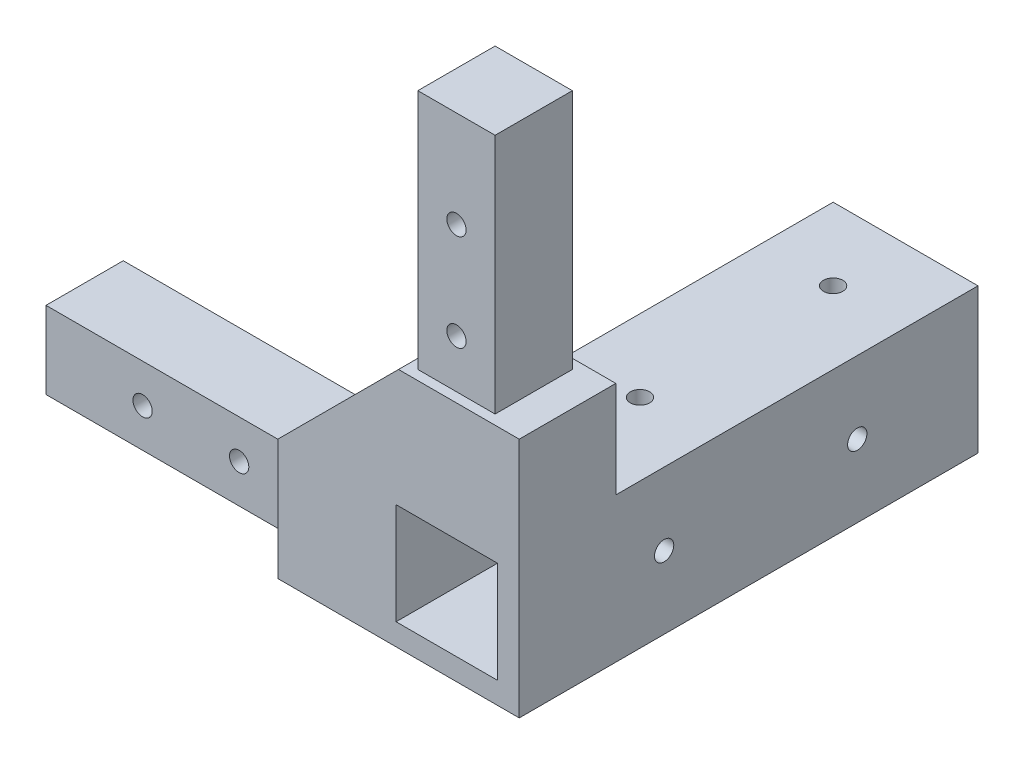
from build123d import *

# Parameters (mm, degrees)
SKETCH1_W           = 100
SKETCH1_H           = 100
BOSS_EXTRUDE1_DEPTH = 100
CUT_EXTRUDE16_DEPTH = 70
SKETCH8_W           = 70
SKETCH8_H           = 70
CUT_EXTRUDE17_DEPTH = 30
SKETCH9_W           = 21
SKETCH9_H           = 21
CUT_EXTRUDE20_DEPTH = 100
SKETCH10_W          = 30
SKETCH10_H          = 30
SKETCH10_W_2        = 16
SKETCH10_H_2        = 16
CUT_EXTRUDE21_DEPTH = 50
SKETCH11_W          = 30
SKETCH11_H          = 30
SKETCH11_W_2        = 20
SKETCH11_H_2        = 20
CUT_EXTRUDE22_DEPTH = 20
SKETCH12_W          = 30
SKETCH12_H          = 30
SKETCH12_W_2        = 20
SKETCH12_H_2        = 20
CUT_EXTRUDE23_DEPTH = 70
SKETCH13_W          = 20
SKETCH13_H          = 20
SKETCH13_W_2        = 16
SKETCH13_H_2        = 16
CUT_EXTRUDE24_DEPTH = 50
SKETCH15_R          = 2
CUT_EXTRUDE25_DEPTH = 30
SKETCH16_R          = 2
CUT_EXTRUDE26_DEPTH = 30
SKETCH17_R          = 2
CUT_EXTRUDE27_DEPTH = 16
SKETCH18_R          = 2
CUT_EXTRUDE29_DEPTH = 16
SKETCH19_W          = 30
SKETCH19_H          = 30
CUT_EXTRUDE30_DEPTH = 5
BOSS_EXTRUDE2_DEPTH = 20
SKETCH21_W          = 20
SKETCH21_H          = 7
BOSS_EXTRUDE6_DEPTH = 24
SKETCH22_W          = 2.5
SKETCH22_H          = 2.5
CUT_EXTRUDE31_DEPTH = 20
SKETCH23_W          = 7
SKETCH23_H          = 20
BOSS_EXTRUDE7_DEPTH = 24


with BuildPart() as part:
    # Sketch1 → Boss-Extrude1 (new body)
    with BuildSketch(Plane.XY):
        Rectangle(SKETCH1_W, SKETCH1_H)
    extrude(amount=-BOSS_EXTRUDE1_DEPTH)

    # Sketch5 → Cut-Extrude16 (cut)
    with BuildSketch(Plane(origin=(0, 0, -100), x_dir=(-1, 0, 0), z_dir=(0, 0, -1))):
        Polygon((50, -50), (50, 50), (-50, 50), (-50, -20), (-20, -20), (-20, -50), align=None)
    extrude(amount=-CUT_EXTRUDE16_DEPTH, mode=Mode.SUBTRACT)

    # Sketch8 → Cut-Extrude17 (cut)
    with BuildSketch(Plane(origin=(0, 0, -30), x_dir=(-1, 0, 0), z_dir=(0, 0, -1))):
        with Locations((15, 15)):
            Rectangle(SKETCH8_W, SKETCH8_H)
    extrude(amount=-CUT_EXTRUDE17_DEPTH, mode=Mode.SUBTRACT)

    # Sketch9 → Cut-Extrude20 (cut)
    with BuildSketch(Plane(origin=(0, 0, -100), x_dir=(-1, 0, 0), z_dir=(0, 0, -1))):
        with Locations((-35, -35)):
            Rectangle(SKETCH9_W, SKETCH9_H)
    extrude(amount=-CUT_EXTRUDE20_DEPTH, mode=Mode.SUBTRACT)

    # Sketch10 → Cut-Extrude21 (cut)
    with BuildSketch(Plane.ZY.offset(50)):
        with Locations((-15, -35)):
            Rectangle(SKETCH10_W, SKETCH10_H)
        with Locations((-15, -35)):
            Rectangle(SKETCH10_W_2, SKETCH10_H_2, mode=Mode.SUBTRACT)
    extrude(amount=-CUT_EXTRUDE21_DEPTH, mode=Mode.SUBTRACT)

    # Sketch11 → Cut-Extrude22 (cut)
    with BuildSketch(Plane.ZY):
        with Locations((-15, -35)):
            Rectangle(SKETCH11_W, SKETCH11_H)
        with Locations((-15, -35)):
            Rectangle(SKETCH11_W_2, SKETCH11_H_2, mode=Mode.SUBTRACT)
    extrude(amount=-CUT_EXTRUDE22_DEPTH, mode=Mode.SUBTRACT)

    # Sketch12 → Cut-Extrude23 (cut)
    with BuildSketch(Plane(origin=(0, 50, 0), x_dir=(1, 0, 0), z_dir=(0, 1, 0))):
        with Locations((35, 15)):
            Rectangle(SKETCH12_W, SKETCH12_H)
        with Locations((35, 15)):
            Rectangle(SKETCH12_W_2, SKETCH12_H_2, mode=Mode.SUBTRACT)
    extrude(amount=-CUT_EXTRUDE23_DEPTH, mode=Mode.SUBTRACT)

    # Sketch13 → Cut-Extrude24 (cut)
    with BuildSketch(Plane(origin=(0, 50, 0), x_dir=(1, 0, 0), z_dir=(0, 1, 0))):
        with Locations((35, 15)):
            Rectangle(SKETCH13_W, SKETCH13_H)
        with Locations((35, 15)):
            Rectangle(SKETCH13_W_2, SKETCH13_H_2, mode=Mode.SUBTRACT)
    extrude(amount=-CUT_EXTRUDE24_DEPTH, mode=Mode.SUBTRACT)

    # Sketch15 → Cut-Extrude25 (cut)
    with BuildSketch(Plane(origin=(0, -20, 0), x_dir=(1, 0, 0), z_dir=(0, 1, 0))):
        with Locations(Location((35, 85, 0), (0, 0, 270))):
            Circle(SKETCH15_R)
        with Locations(Location((35, 45, 0), (0, 0, 270))):
            Circle(SKETCH15_R)
    extrude(amount=-CUT_EXTRUDE25_DEPTH, mode=Mode.SUBTRACT)

    # Sketch16 → Cut-Extrude26 (cut)
    with BuildSketch(Plane(origin=(50, 0, 0), x_dir=(0, 0, -1), z_dir=(1, 0, 0))):
        with Locations((75, -35)):
            Circle(SKETCH16_R)
        with Locations((35, -35)):
            Circle(SKETCH16_R)
    extrude(amount=-CUT_EXTRUDE26_DEPTH, mode=Mode.SUBTRACT)

    # Sketch17 → Cut-Extrude27 (cut)
    with BuildSketch(Plane(origin=(0, 0, -23), x_dir=(-1, 0, 0), z_dir=(0, 0, -1))):
        with Locations((-35, 30)):
            Circle(SKETCH17_R)
        with Locations((-35, 10)):
            Circle(SKETCH17_R)
    extrude(amount=-CUT_EXTRUDE27_DEPTH, mode=Mode.SUBTRACT)

    # Sketch18 → Cut-Extrude29 (cut)
    with BuildSketch(Plane(origin=(0, 0, -23), x_dir=(-1, 0, 0), z_dir=(0, 0, -1))):
        with Locations((30, -35)):
            Circle(SKETCH18_R)
        with Locations((10, -35)):
            Circle(SKETCH18_R)
    extrude(amount=-CUT_EXTRUDE29_DEPTH, mode=Mode.SUBTRACT)

    # Sketch19 → Cut-Extrude30 (cut)
    with BuildSketch(Plane.XY):
        with Locations((35, -35)):
            Rectangle(SKETCH19_W, SKETCH19_H)
    extrude(amount=-CUT_EXTRUDE30_DEPTH, mode=Mode.SUBTRACT)

    # Sketch20 → Boss-Extrude2 (add)
    with BuildSketch(Plane.XY.offset(-5)):
        Polygon((25, 0), (0, -25), (0, -27), (27, -27), (27, 0), align=None)
    extrude(amount=-BOSS_EXTRUDE2_DEPTH)

    # Sketch21 → Boss-Extrude6 (add)
    with BuildSketch(Plane.ZY):
        with Locations((-15, -46.5)):
            Rectangle(SKETCH21_W, SKETCH21_H)
    extrude(amount=-BOSS_EXTRUDE6_DEPTH)

    # Sketch22 → Cut-Extrude31 (cut)
    with BuildSketch(Plane(origin=(0, 0, -25), x_dir=(-1, 0, 0), z_dir=(0, 0, -1))):
        with Locations((-25.75, -25.75)):
            Rectangle(SKETCH22_W, SKETCH22_H)
    extrude(amount=-CUT_EXTRUDE31_DEPTH, mode=Mode.SUBTRACT)

    # Sketch23 → Boss-Extrude7 (add)
    with BuildSketch(Plane(origin=(0, 0, 0), x_dir=(1, 0, 0), z_dir=(0, 1, 0))):
        with Locations((46.5, 15)):
            Rectangle(SKETCH23_W, SKETCH23_H)
    extrude(amount=-BOSS_EXTRUDE7_DEPTH)


solid = part.part
